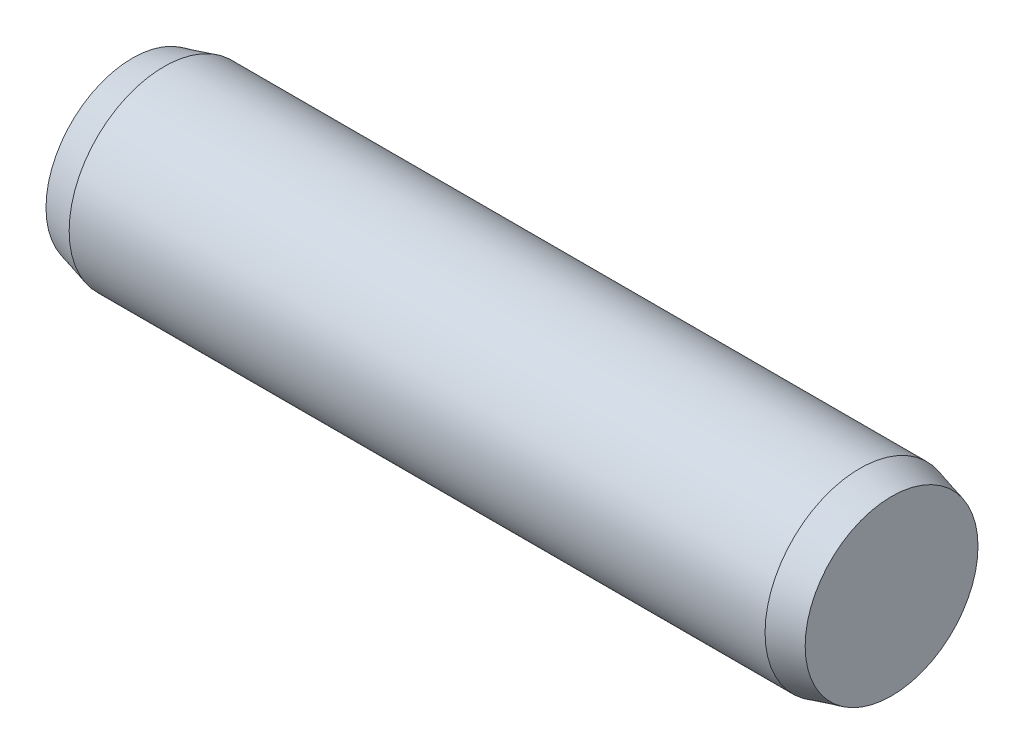
from build123d import *

# Parameters (mm, degrees)
EXTRUDE1_DEPTH      = 5.5
EXTRUDE1_DEPTH_BACK = 5.5
SKETCH2_R           = 1.5
SKETCH3_R           = 1.5
EXTRUDE2_DEPTH      = 0.5
EXTRUDE2_TAPER      = 15
SKETCH4_R           = 1.5
EXTRUDE3_DEPTH      = 0.5
EXTRUDE3_TAPER      = 15


with BuildPart() as part:
    # Sketch2 → Extrude1 (new, two sides: drawn at the far end of the back side and taken through both)
    with BuildSketch(Plane(origin=(0, 0, 0), x_dir=(0, 0, -1), z_dir=(1, 0, 0)).offset(-EXTRUDE1_DEPTH_BACK)):
        Circle(SKETCH2_R)
    extrude(amount=EXTRUDE1_DEPTH + EXTRUDE1_DEPTH_BACK)

    # Sketch3 → Extrude2 (add)
    with BuildSketch(Plane(origin=(5.5, 0, 0), x_dir=(0, 0, -1), z_dir=(1, 0, 0))):
        Circle(SKETCH3_R)
    extrude(amount=EXTRUDE2_DEPTH, taper=EXTRUDE2_TAPER)

    # Sketch4 → Extrude3 (add)
    with BuildSketch(Plane.ZY.offset(5.5)):
        with Locations(Location((0, 0, 0), (0, 0, 180))):
            Circle(SKETCH4_R)
    extrude(amount=EXTRUDE3_DEPTH, taper=EXTRUDE3_TAPER)


solid = part.part
